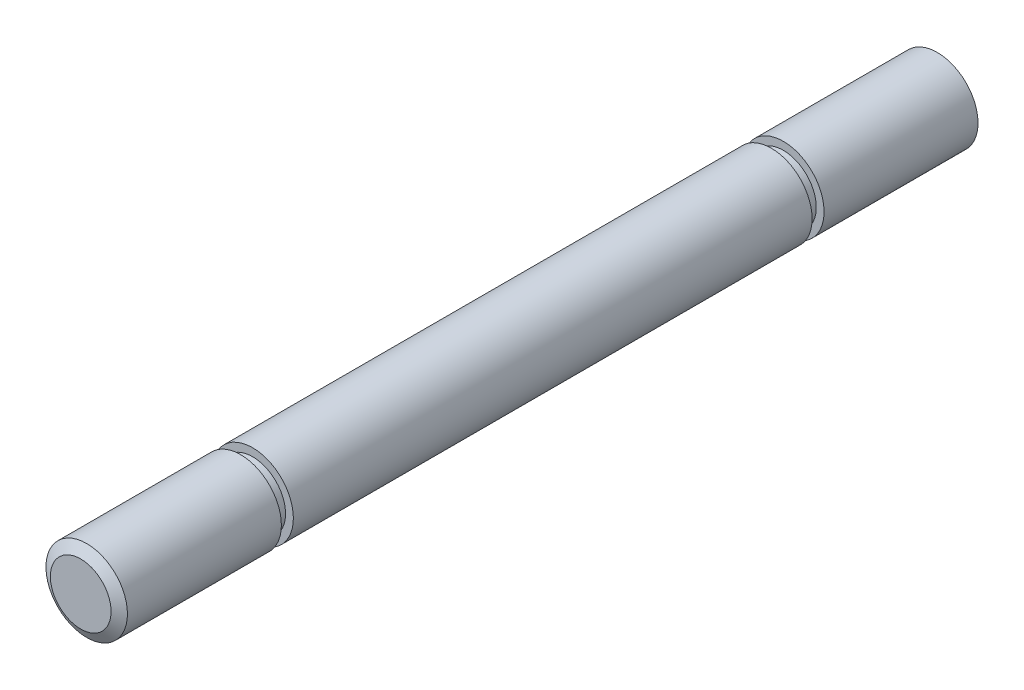
from build123d import *

# Parameters (mm, degrees)
CHAMFER1_SIZE      = 0.5
CHAMFER1_SIZE2     = 0.866025404
CUT_EXTRUDE1_START = -13.35
SKETCH2_OUTSIDE_W  = 23.328
SKETCH2_OUTSIDE_H  = 23.328
SKETCH2_OUTSIDE_R  = 2.75
CUT_EXTRUDE1_DEPTH = 1


with BuildPart() as part:
    # Sketch1 → Revolve1 (revolve)
    with BuildSketch(Plane(origin=(0, 0, 0), x_dir=(0, 0, -1), z_dir=(1, 0, 0)), mode=Mode.PRIVATE) as revolve1_sk:
        Polygon((-36, 0), (-36, 3.4), (2.432191781, 3.4), (36, 3.4), (36, 0), align=None)
    revolve(revolve1_sk.sketch.rotate(Axis((0, 0, 36), (0, 0, -1)), 180), axis=Axis((0, 0, 36), (0, 0, -1)))

    # Chamfer1
    chamfer1_edges = [part.edges().sort_by_distance(p)[0] for p in [
        (0, 3.4, -36),
        (0, 3.4, 36),
    ]]
    chamfer1_side = [part.faces().sort_by_distance(p)[0] for p in [
        (0, 3.4, 0),
    ]]
    chamfer(chamfer1_edges, length=CHAMFER1_SIZE, length2=CHAMFER1_SIZE2, reference=chamfer1_side[0])

    # Sketch2 outside → Cut-Extrude1 (cut)
    with BuildSketch(Plane(origin=(0, 0, -36), x_dir=(-1, 0, 0), z_dir=(0, 0, -1)).offset(CUT_EXTRUDE1_START)):
        Rectangle(SKETCH2_OUTSIDE_W, SKETCH2_OUTSIDE_H)
        Circle(SKETCH2_OUTSIDE_R, mode=Mode.SUBTRACT)
    cut_extrude1 = extrude(amount=-CUT_EXTRUDE1_DEPTH, mode=Mode.SUBTRACT)

    # Mirror1: Cut-Extrude1 across plane
    add(cut_extrude1.mirror(Plane.XY), mode=Mode.SUBTRACT)


solid = part.part
